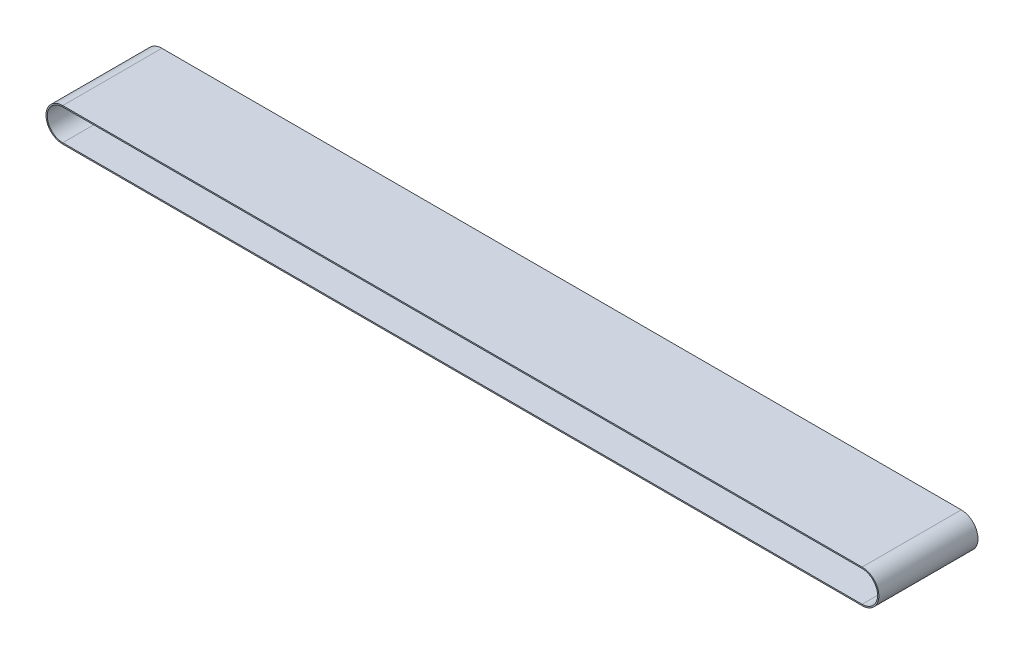
from build123d import *

# Parameters (mm, degrees)
BOSS_EXTRUDE1_DEPTH = 160


with BuildPart() as part:
    # Sketch1 → Boss-Extrude1 (new body)
    with BuildSketch(Plane.XY):
        with BuildLine():
            Line((-645, 27), (645, 27))
            ThreePointArc((645, 27), (672, 0), (645, -27))
            Line((645, -27), (-645, -27))
            ThreePointArc((-645, -27), (-672, 0), (-645, 27))
        make_face()
        with BuildLine():
            Line((-645, 25), (645, 25))
            ThreePointArc((645, 25), (670, 0), (645, -25))
            Line((645, -25), (-645, -25))
            ThreePointArc((-645, -25), (-670, 0), (-645, 25))
        make_face(mode=Mode.SUBTRACT)
    extrude(amount=BOSS_EXTRUDE1_DEPTH)


solid = part.part
